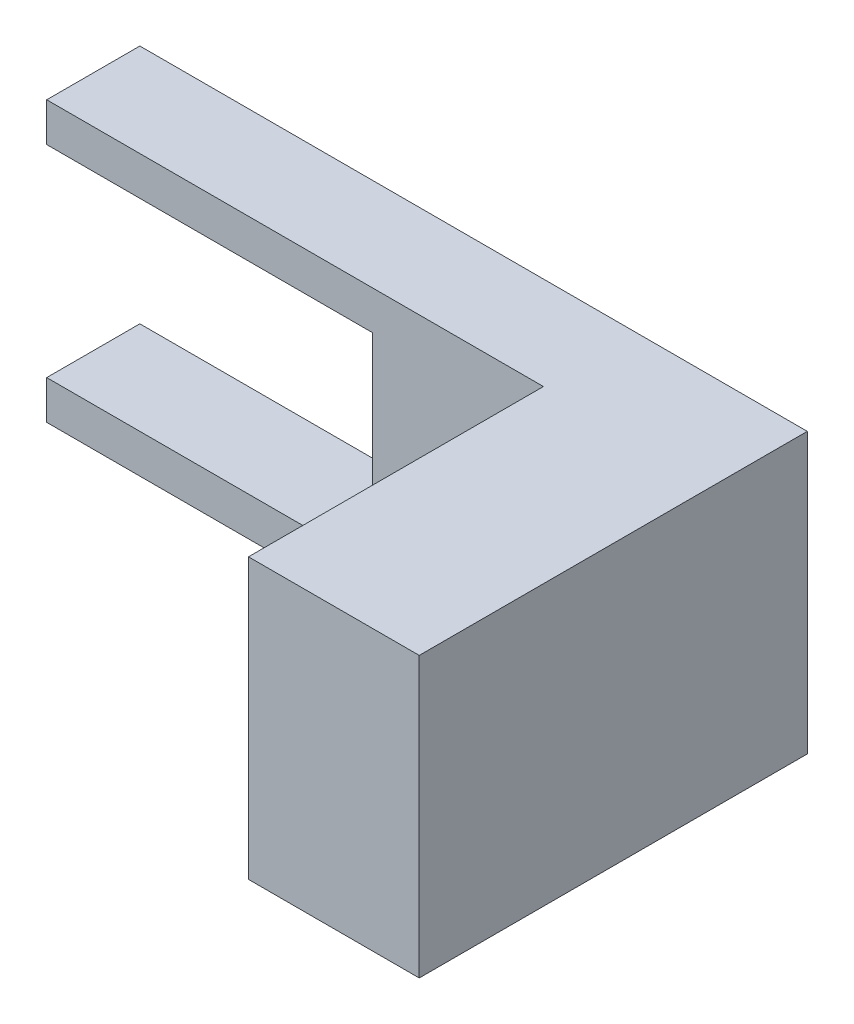
from build123d import *

# Parameters (mm, degrees)
BOSS_EXTRUDE1_DEPTH = 18
SKETCH2_W           = 42
SKETCH2_H           = 13
CUT_EXTRUDE1_DEPTH  = 42.832217781


with BuildPart() as part:
    # Sketch1 → Boss-Extrude1 (new body)
    with BuildSketch(Plane(origin=(0, 0, 0), x_dir=(1, 0, 0), z_dir=(0, 1, 0))):
        Polygon((-10.366666667, 24.383333333), (32.633333333, 24.383333333), (32.633333333, -0.616666667), (21.633333333, -0.616666667), (21.633333333, 18.383333333), (-10.366666667, 18.383333333), align=None)
    extrude(amount=BOSS_EXTRUDE1_DEPTH)

    # Sketch2 → Cut-Extrude1 (cut, through all)
    with BuildSketch(Plane.XY.offset(-18.383333333)):
        with Locations((-10.366666667, 9)):
            Rectangle(SKETCH2_W, SKETCH2_H)
    extrude(amount=-CUT_EXTRUDE1_DEPTH, mode=Mode.SUBTRACT)


solid = part.part
